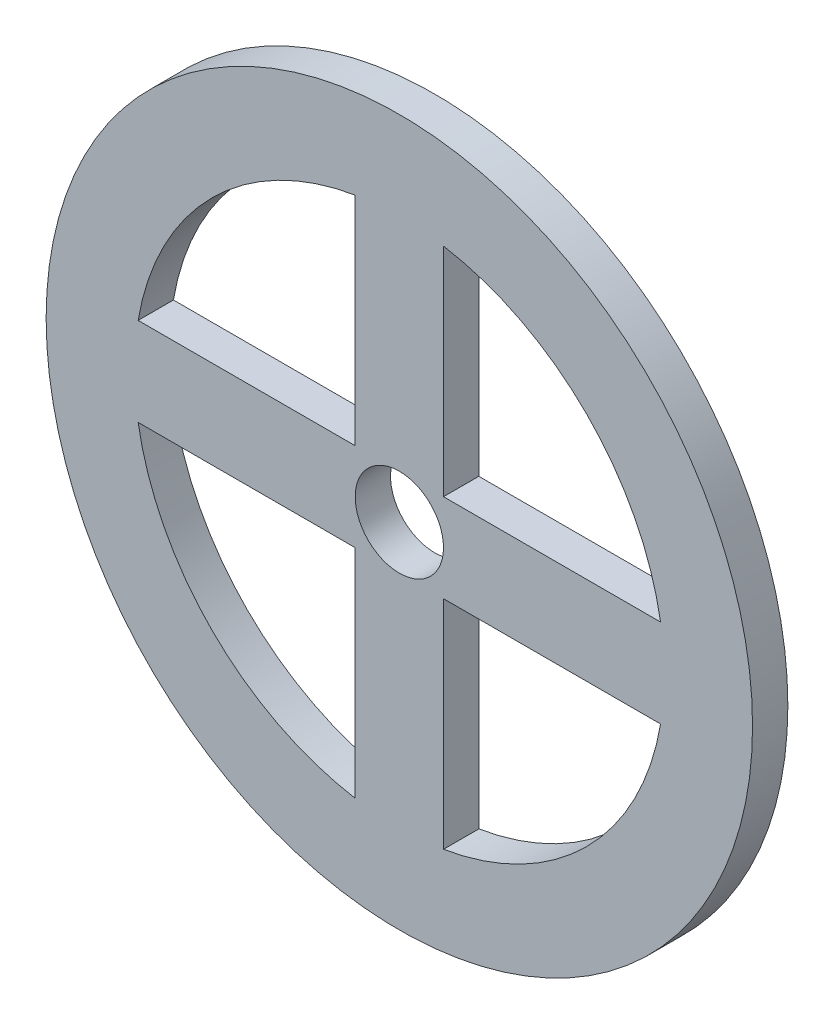
from build123d import *

# Parameters (mm, degrees)
SKETCH1_R           = 25.4
BOSS_EXTRUDE1_DEPTH = 2.54
SKETCH1_4_R         = 3.175
CUT_EXTRUDE2_DEPTH  = 2.54


with BuildPart() as part:
    # Sketch1 → Boss-Extrude1 (new body)
    with BuildSketch(Plane.XY):
        Circle(SKETCH1_R)
    extrude(amount=BOSS_EXTRUDE1_DEPTH)

    # Sketch1<4> → Cut-Extrude2 (cut)
    with BuildSketch(Plane.XY):
        Circle(SKETCH1_4_R)
        with BuildLine():
            Line((-18.783553311, 3.175), (-3.175, 3.175))
            Line((-3.175, 3.175), (-3.175, 18.783553311))
            ThreePointArc((-3.175, 18.783553311), (-13.470384182, 13.470384182), (-18.783553311, 3.175))
        make_face()
        with BuildLine():
            Line((-3.175, -18.783553311), (-3.175, -3.175))
            Line((-3.175, -3.175), (-18.783553311, -3.175))
            ThreePointArc((-18.783553311, -3.175), (-13.470384182, -13.470384182), (-3.175, -18.783553311))
        make_face()
        with BuildLine():
            Line((3.175, 18.783553311), (3.175, 3.175))
            Line((3.175, 3.175), (18.783553311, 3.175))
            ThreePointArc((18.783553311, 3.175), (13.470384182, 13.470384182), (3.175, 18.783553311))
        make_face()
        with BuildLine():
            Line((18.783553311, -3.175), (3.175, -3.175))
            Line((3.175, -3.175), (3.175, -18.783553311))
            ThreePointArc((3.175, -18.783553311), (13.470384182, -13.470384182), (18.783553311, -3.175))
        make_face()
    extrude(amount=CUT_EXTRUDE2_DEPTH, mode=Mode.SUBTRACT)


solid = part.part
